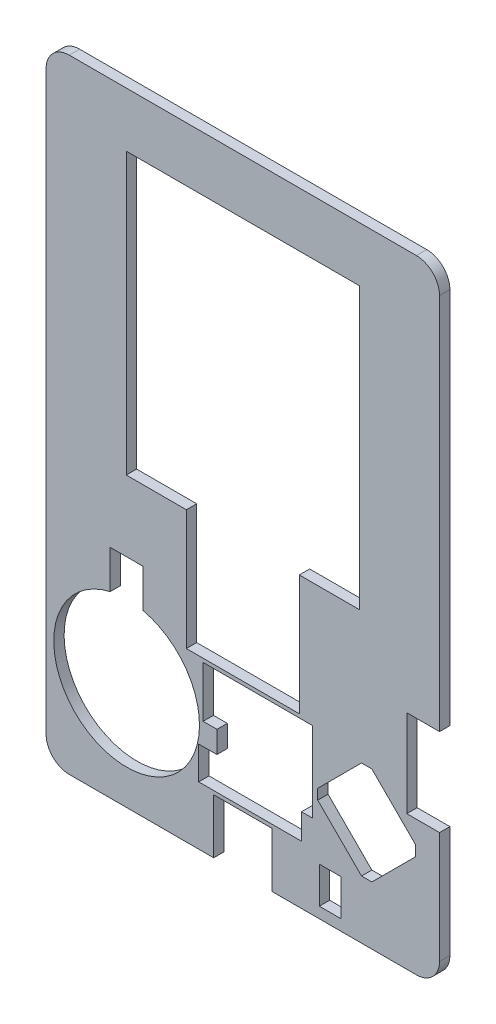
from build123d import *

# Parameters (mm, degrees)
EXTRUDE_1_DEPTH     = 1.42
CUT_EXTRUDE_1_REACH = 52.582
SKETCH_2_W          = 32
SKETCH_2_H          = 38.5
SKETCH_2_W_2        = 15.5
SKETCH_2_H_2        = 16.5
CUT_EXTRUDE_2_REACH = 52.582
SKETCH_3_R          = 10
CUT_EXTRUDE_3_REACH = 52.582
CUT_EXTRUDE_4_REACH = 52.582
SKETCH_5_W          = 8
SKETCH_5_H          = 7.5
CUT_EXTRUDE_5_REACH = 52.582
SKETCH_6_W          = 3
SKETCH_6_H          = 5
CUT_EXTRUDE_6_REACH = 52.582
SKETCH_7_W          = 4.5
SKETCH_7_H          = 12


with BuildPart() as part:
    # 草图1 → 凸台-拉伸1 (new body)
    with BuildSketch(Plane.XY):
        with BuildLine():
            Line((-23.82, -42.75), (23.82, -42.75))
            ThreePointArc((23.82, -42.75), (26.068599564, -41.818599564), (27, -39.57))
            Line((27, -39.57), (27, 39.57))
            ThreePointArc((27, 39.57), (26.068599564, 41.818599564), (23.82, 42.75))
            Line((23.82, 42.75), (-23.82, 42.75))
            ThreePointArc((-23.82, 42.75), (-26.068599564, 41.818599564), (-27, 39.57))
            Line((-27, 39.57), (-27, -39.57))
            ThreePointArc((-27, -39.57), (-26.068599564, -41.818599564), (-23.82, -42.75))
        make_face()
    extrude(amount=EXTRUDE_1_DEPTH)

    # 草图2 → 切除-拉伸1 (cut, up to next)
    with BuildSketch(Plane.XY.offset(1.42), mode=Mode.PRIVATE) as cut_extrude_1_sk1:
        with Locations((0, 16)):
            Rectangle(SKETCH_2_W, SKETCH_2_H)
    cut_extrude_1_tool1 = extrude(cut_extrude_1_sk1.sketch, amount=-CUT_EXTRUDE_1_REACH, mode=Mode.PRIVATE) & part.part
    # 草图2 → 切除-拉伸1 (cut, up to next)
    with BuildSketch(Plane.XY.offset(1.42), mode=Mode.PRIVATE) as cut_extrude_1_sk2:
        with Locations((0, -11.5)):
            Rectangle(SKETCH_2_W_2, SKETCH_2_H_2)
    cut_extrude_1_tool2 = extrude(cut_extrude_1_sk2.sketch, amount=-CUT_EXTRUDE_1_REACH, mode=Mode.PRIVATE) & part.part
    add(cut_extrude_1_tool1.solids().sort_by_distance((0, 16, 1.42))[0], mode=Mode.SUBTRACT)
    add(cut_extrude_1_tool2.solids().sort_by_distance((0, -11.5, 1.42))[0], mode=Mode.SUBTRACT)

    # 草图3 → 切除-拉伸2 (cut, up to next)
    with BuildSketch(Plane.XY.offset(1.42), mode=Mode.PRIVATE) as cut_extrude_2_sk1:
        with Locations((-15.95, -27.95)):
            Circle(SKETCH_3_R)
    cut_extrude_2_tool1 = extrude(cut_extrude_2_sk1.sketch, amount=-CUT_EXTRUDE_2_REACH, mode=Mode.PRIVATE) & part.part
    # 草图3 → 切除-拉伸2 (cut, up to next)
    with BuildSketch(Plane.XY.offset(1.42), mode=Mode.PRIVATE) as cut_extrude_2_sk2:
        with BuildLine():
            Line((-18.2, -12.95), (-18.2, -18.206412365))
            ThreePointArc((-18.2, -18.206412365), (-15.95, -17.95), (-13.7, -18.206412365))
            Line((-13.7, -18.206412365), (-13.7, -12.95))
            Line((-13.7, -12.95), (-18.2, -12.95))
        make_face()
    cut_extrude_2_tool2 = extrude(cut_extrude_2_sk2.sketch, amount=-CUT_EXTRUDE_2_REACH, mode=Mode.PRIVATE) & part.part
    add(cut_extrude_2_tool1.solids().sort_by_distance((-15.95, -27.95, 1.42))[0], mode=Mode.SUBTRACT)
    add(cut_extrude_2_tool2.solids().sort_by_distance((-15.95, -15.493086, 1.42))[0], mode=Mode.SUBTRACT)

    # 草图4 → 切除-拉伸3 (cut, up to next)
    with BuildSketch(Plane.XY.offset(1.42), mode=Mode.PRIVATE) as cut_extrude_3_sk1:
        Polygon((-5.45, -20.25), (9.55, -20.25), (9.55, -31.25), (8.05, -31.25), (8.05, -34.75), (-6.05, -34.75), (-6.05, -30.25), (-3.55, -30.25), (-3.55, -27.25), (-5.45, -27.25), align=None)
    cut_extrude_3_tool1 = extrude(cut_extrude_3_sk1.sketch, amount=-CUT_EXTRUDE_3_REACH, mode=Mode.PRIVATE) & part.part
    add(cut_extrude_3_tool1.solids().sort_by_distance((1.958423, -27.392473, 1.42))[0], mode=Mode.SUBTRACT)

    # 草图5 → 切除-拉伸4 (cut, up to next)
    with BuildSketch(Plane.XY.offset(1.42), mode=Mode.PRIVATE) as cut_extrude_4_sk1:
        with Locations((0, -39)):
            Rectangle(SKETCH_5_W, SKETCH_5_H)
    cut_extrude_4_tool1 = extrude(cut_extrude_4_sk1.sketch, amount=-CUT_EXTRUDE_4_REACH, mode=Mode.PRIVATE) & part.part
    add(cut_extrude_4_tool1.solids().sort_by_distance((0, -39, 1.42))[0], mode=Mode.SUBTRACT)

    # 草图6 → 切除-拉伸5 (cut, up to next)
    with BuildSketch(Plane.XY.offset(1.42), mode=Mode.PRIVATE) as cut_extrude_5_sk1:
        with Locations((12, -38.75)):
            Rectangle(SKETCH_6_W, SKETCH_6_H)
    cut_extrude_5_tool1 = extrude(cut_extrude_5_sk1.sketch, amount=-CUT_EXTRUDE_5_REACH, mode=Mode.PRIVATE) & part.part
    # 草图6 → 切除-拉伸5 (cut, up to next)
    with BuildSketch(Plane.XY.offset(1.42), mode=Mode.PRIVATE) as cut_extrude_5_sk2:
        Polygon((17.707106781, -34.767514421), (23.717514421, -28.757106781), (23.717514421, -27.342893219), (17.707106781, -21.332485579), (16.292893219, -21.332485579), (10.282485579, -27.342893219), (10.282485579, -28.757106781), (16.292893219, -34.767514421), align=None)
    cut_extrude_5_tool2 = extrude(cut_extrude_5_sk2.sketch, amount=-CUT_EXTRUDE_5_REACH, mode=Mode.PRIVATE) & part.part
    add(cut_extrude_5_tool1.solids().sort_by_distance((12, -38.75, 1.42))[0], mode=Mode.SUBTRACT)
    add(cut_extrude_5_tool2.solids().sort_by_distance((17, -28.05, 1.42))[0], mode=Mode.SUBTRACT)

    # 草图7 → 切除-拉伸6 (cut, up to next)
    with BuildSketch(Plane.XY.offset(1.42), mode=Mode.PRIVATE) as cut_extrude_6_sk1:
        with Locations((24.75, -18.25)):
            Rectangle(SKETCH_7_W, SKETCH_7_H)
    cut_extrude_6_tool1 = extrude(cut_extrude_6_sk1.sketch, amount=-CUT_EXTRUDE_6_REACH, mode=Mode.PRIVATE) & part.part
    add(cut_extrude_6_tool1.solids().sort_by_distance((24.75, -18.25, 1.42))[0], mode=Mode.SUBTRACT)


solid = part.part
